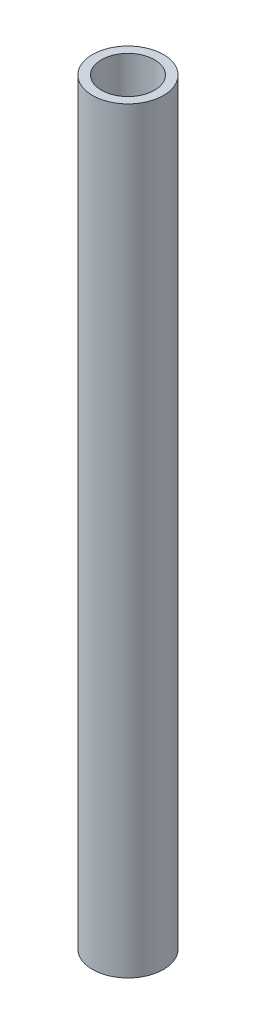
from build123d import *

# Parameters (mm, degrees)
SKETCH1_R           = 9.525
SKETCH1_R_2         = 7.112
BOSS_EXTRUDE1_DEPTH = 203.2


with BuildPart() as part:
    # Sketch1 → Boss-Extrude1 (new body)
    with BuildSketch(Plane(origin=(0, 0, 0), x_dir=(1, 0, 0), z_dir=(0, 1, 0))):
        with Locations(Location((0, 0, 0), (0, 0, 270))):
            Circle(SKETCH1_R)
        with Locations(Location((0, 0, 0), (0, 0, 270))):
            Circle(SKETCH1_R_2, mode=Mode.SUBTRACT)
    extrude(amount=BOSS_EXTRUDE1_DEPTH)


solid = part.part
